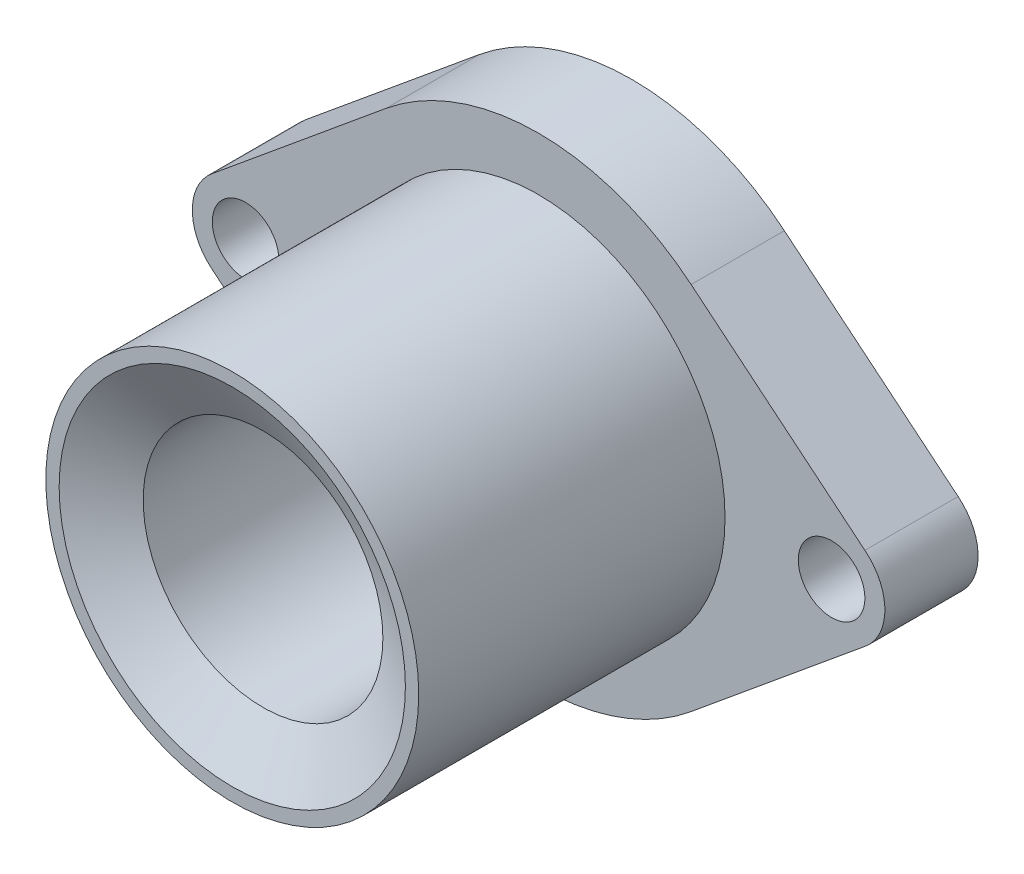
from build123d import *

# Parameters (mm, degrees)
SKETCH_1_R          = 2.5
EXTRUDE_1_DEPTH     = 7
SKETCH_1_5_R        = 14
SKETCH_1_5_R_2      = 9
EXTRUDE_3_DEPTH     = 30
SKETCH_1_6_R        = 9
CUT_EXTRUDE_2_DEPTH = 7
CHAMFER_1_SIZE      = 4
CHAMFER_1_SIZE2     = 2.309401077


with BuildPart() as part:
    # 草图1 → 凸台-拉伸1 (new body)
    with BuildSketch(Plane.XY):
        with BuildLine():
            Line((-11.454897552, 13.884715412), (-24.5, 3.122498999))
            ThreePointArc((-24.5, 3.122498999), (-26, 0), (-24.5, -3.122498999))
            Line((-24.5, -3.122498999), (-11.454897552, -13.884715412))
            ThreePointArc((-11.454897552, -13.884715412), (0, -18), (11.454897552, -13.884715412))
            Line((11.454897552, -13.884715412), (24.5, -3.122498999))
            ThreePointArc((24.5, -3.122498999), (26, 0), (24.5, 3.122498999))
            Line((24.5, 3.122498999), (11.454897552, 13.884715412))
            ThreePointArc((11.454897552, 13.884715412), (0, 18), (-11.454897552, 13.884715412))
        make_face()
        with Locations((-22, 0)):
            Circle(SKETCH_1_R, mode=Mode.SUBTRACT)
        with Locations((22, 0)):
            Circle(SKETCH_1_R, mode=Mode.SUBTRACT)
    extrude(amount=EXTRUDE_1_DEPTH)

    # 草图1<5> → 凸台-拉伸3 (add)
    with BuildSketch(Plane.XY):
        Circle(SKETCH_1_5_R)
        Circle(SKETCH_1_5_R_2, mode=Mode.SUBTRACT)
    extrude(amount=EXTRUDE_3_DEPTH)

    # 草图1<6> → 切除-拉伸2 (cut)
    with BuildSketch(Plane.XY):
        Circle(SKETCH_1_6_R)
    extrude(amount=CUT_EXTRUDE_2_DEPTH, mode=Mode.SUBTRACT)

    # 倒角1
    chamfer_1_edges = [part.edges().sort_by_distance(p)[0] for p in [
        (-9, 0, 30),
    ]]
    chamfer_1_side = [part.faces().sort_by_distance(p)[0] for p in [
        (-13.604020203, 0, 30),
    ]]
    chamfer(chamfer_1_edges, length=CHAMFER_1_SIZE, length2=CHAMFER_1_SIZE2, reference=chamfer_1_side[0])


solid = part.part
